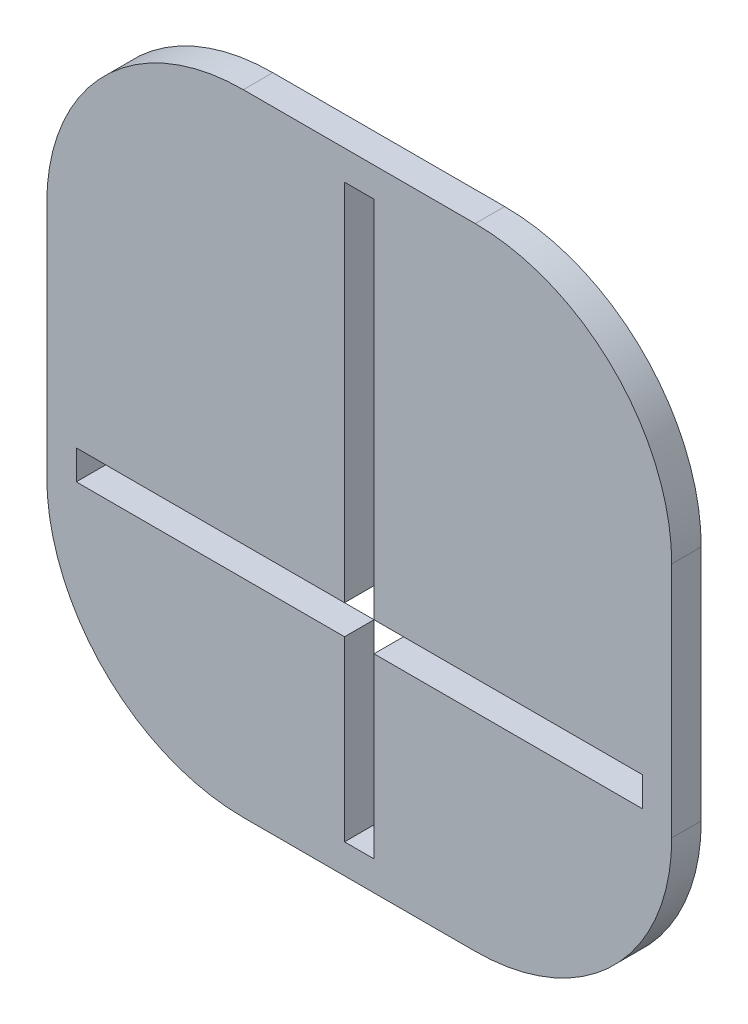
from build123d import *

# Parameters (mm, degrees)
SALIENTE_EXTRUIR1_DEPTH = 3


with BuildPart() as part:
    # Croquis1 → Saliente-Extruir1 (new body)
    with BuildSketch(Plane.XY):
        with BuildLine():
            Line((-11.8, -32.07), (11.8, -32.07))
            ThreePointArc((11.8, -32.07), (25.942135624, -26.212135624), (31.8, -12.07))
            Line((31.8, -12.07), (31.8, 12.07))
            ThreePointArc((31.8, 12.07), (25.942135624, 26.212135624), (11.8, 32.07))
            Line((11.8, 32.07), (-11.8, 32.07))
            ThreePointArc((-11.8, 32.07), (-25.942135624, 26.212135624), (-31.8, 12.07))
            Line((-31.8, 12.07), (-31.8, -12.07))
            ThreePointArc((-31.8, -12.07), (-25.942135624, -26.212135624), (-11.8, -32.07))
        make_face()
        Polygon((-28.8, -10.995), (-28.8, -7.995), (-1.5, -7.995), (-1.5, 29.07), (1.5, 29.07), (1.5, -7.995), (28.8, -7.995), (28.8, -10.995), (1.5, -10.995), (1.5, -29.07), (-1.5, -29.07), (-1.5, -10.995), align=None, mode=Mode.SUBTRACT)
    extrude(amount=SALIENTE_EXTRUIR1_DEPTH)


solid = part.part
